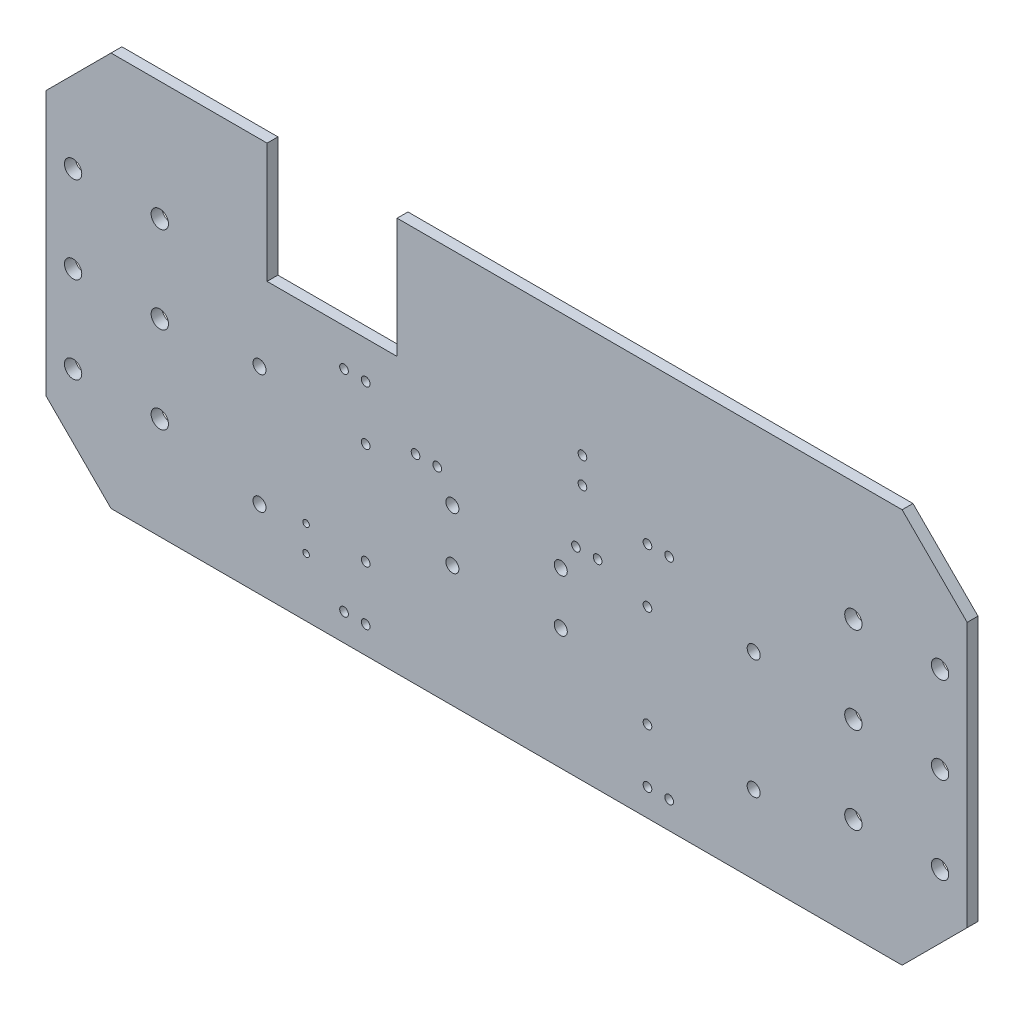
from build123d import *

# Parameters (mm, degrees)
SKETCH_1_W          = 425
SKETCH_1_H          = 182
EXTRUDE_1_DEPTH     = 5
SKETCH_2_R          = 3
SKETCH_2_R_2        = 4
SKETCH_2_R_3        = 2
SKETCH_2_R_4        = 1.5
CUT_EXTRUDE_2_DEPTH = 232.219051983
SKETCH_3_W          = 60
SKETCH_3_H          = 55.25
CUT_EXTRUDE_3_DEPTH = 10
CHAMFER_1_SIZE      = 30


with BuildPart() as part:
    # 草图1 → 凸台-拉伸1 (new body)
    with BuildSketch(Plane.XY):
        Rectangle(SKETCH_1_W, SKETCH_1_H)
    extrude(amount=EXTRUDE_1_DEPTH)

    # 草图2 → 切除-拉伸2 (cut, through all)
    with BuildSketch(Plane.XY):
        with Locations((-25, -11)):
            Circle(SKETCH_2_R)
        with Locations((-25, -35)):
            Circle(SKETCH_2_R)
        with Locations(Location((25, -35, 0), (0, 0, 180))):
            Circle(SKETCH_2_R)
        with Locations(Location((25, -11, 0), (0, 0, 180))):
            Circle(SKETCH_2_R)
        with Locations((-200, 36)):
            Circle(SKETCH_2_R_2)
        with Locations((-160, 36)):
            Circle(SKETCH_2_R_2)
        with Locations((-200, -4)):
            Circle(SKETCH_2_R_2)
        with Locations((-160, -4)):
            Circle(SKETCH_2_R_2)
        with Locations(Location((160, -4, 0), (0, 0, 180))):
            Circle(SKETCH_2_R_2)
        with Locations(Location((200, -4, 0), (0, 0, 180))):
            Circle(SKETCH_2_R_2)
        with Locations(Location((160, 36, 0), (0, 0, 180))):
            Circle(SKETCH_2_R_2)
        with Locations(Location((200, 36, 0), (0, 0, 180))):
            Circle(SKETCH_2_R_2)
        with Locations((-200, -44)):
            Circle(SKETCH_2_R_2)
        with Locations((-160, -44)):
            Circle(SKETCH_2_R_2)
        with Locations(Location((160, -44, 0), (0, 0, 180))):
            Circle(SKETCH_2_R_2)
        with Locations(Location((200, -44, 0), (0, 0, 180))):
            Circle(SKETCH_2_R_2)
        with Locations((-32, 1)):
            Circle(SKETCH_2_R_3)
        with Locations((-42, 1)):
            Circle(SKETCH_2_R_3)
        with Locations(Location((32, 1, 0), (0, 0, 180))):
            Circle(SKETCH_2_R_3)
        with Locations(Location((42, 1, 0), (0, 0, 180))):
            Circle(SKETCH_2_R_3)
        with Locations((35, 39)):
            Circle(SKETCH_2_R_3)
        with Locations((35, 27)):
            Circle(SKETCH_2_R_3)
        with Locations((-75, -78.5)):
            Circle(SKETCH_2_R_3)
        with Locations((-65, -78.5)):
            Circle(SKETCH_2_R_3)
        with Locations((-65, -53.5)):
            Circle(SKETCH_2_R_3)
        with Locations((-65, -6.5)):
            Circle(SKETCH_2_R_3)
        with Locations((-65, 18.5)):
            Circle(SKETCH_2_R_3)
        with Locations((-75, 18.5)):
            Circle(SKETCH_2_R_3)
        with Locations(Location((75, -78.5, 0), (0, 0, 180))):
            Circle(SKETCH_2_R_3)
        with Locations(Location((65, -78.5, 0), (0, 0, 180))):
            Circle(SKETCH_2_R_3)
        with Locations(Location((65, -53.5, 0), (0, 0, 180))):
            Circle(SKETCH_2_R_3)
        with Locations(Location((65, -6.5, 0), (0, 0, 180))):
            Circle(SKETCH_2_R_3)
        with Locations(Location((65, 18.5, 0), (0, 0, 180))):
            Circle(SKETCH_2_R_3)
        with Locations(Location((75, 18.5, 0), (0, 0, 180))):
            Circle(SKETCH_2_R_3)
        with Locations((-114, -55)):
            Circle(SKETCH_2_R)
        with Locations((-114, 0)):
            Circle(SKETCH_2_R)
        with Locations(Location((114, 0, 0), (0, 0, 180))):
            Circle(SKETCH_2_R)
        with Locations(Location((114, -55, 0), (0, 0, 180))):
            Circle(SKETCH_2_R)
        with Locations((-92.5, -52)):
            Circle(SKETCH_2_R_4)
        with Locations((-92.5, -64)):
            Circle(SKETCH_2_R_4)
    extrude(amount=CUT_EXTRUDE_2_DEPTH, mode=Mode.SUBTRACT)

    # 草图3 → 切除-拉伸3 (cut)
    with BuildSketch(Plane.XY.offset(5)):
        with Locations((-80.5, 63.375)):
            Rectangle(SKETCH_3_W, SKETCH_3_H)
    extrude(amount=-CUT_EXTRUDE_3_DEPTH, mode=Mode.SUBTRACT)

    # 倒角1
    chamfer_1_edges = [part.edges().sort_by_distance(p)[0] for p in [
        (-212.5, 91, 2.5),
        (212.5, 91, 2.5),
        (212.5, -91, 2.5),
        (-212.5, -91, 2.5),
    ]]
    chamfer(chamfer_1_edges, length=CHAMFER_1_SIZE)


solid = part.part
